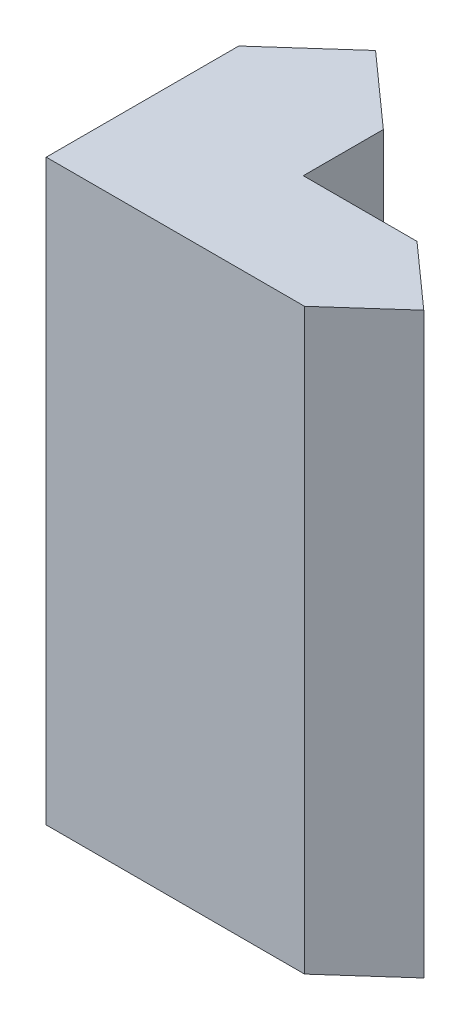
from build123d import *

# Parameters (mm, degrees)
EXTRUDE_1_DEPTH     = 180
SKETCH_4_W          = 115.68849301
SKETCH_4_H          = 90
CUT_EXTRUDE_1_DEPTH = 200


with BuildPart() as part:
    # 草图1 → 凸台-拉伸1 (new body)
    with BuildSketch(Plane(origin=(0, 0, 0), x_dir=(1, 0, 0), z_dir=(0, 1, 0))):
        Polygon((-18.406325618, 0), (61.985157699, 0), (81.593674382, 17.5), (61.985157699, 35), (26.593674382, 35), (26.593674382, 59.919439784), (4.093674382, 80), (-18.406325618, 59.919439784), align=None)
    extrude(amount=EXTRUDE_1_DEPTH)

    # 草图4 → 切除-拉伸1 (cut)
    with BuildSketch(Plane(origin=(26.593674382, 0, 0), x_dir=(0, 0, -1), z_dir=(1, 0, 0))):
        with Locations((92.844246505, 45)):
            Rectangle(SKETCH_4_W, SKETCH_4_H)
    extrude(amount=-CUT_EXTRUDE_1_DEPTH, mode=Mode.SUBTRACT)


solid = part.part
